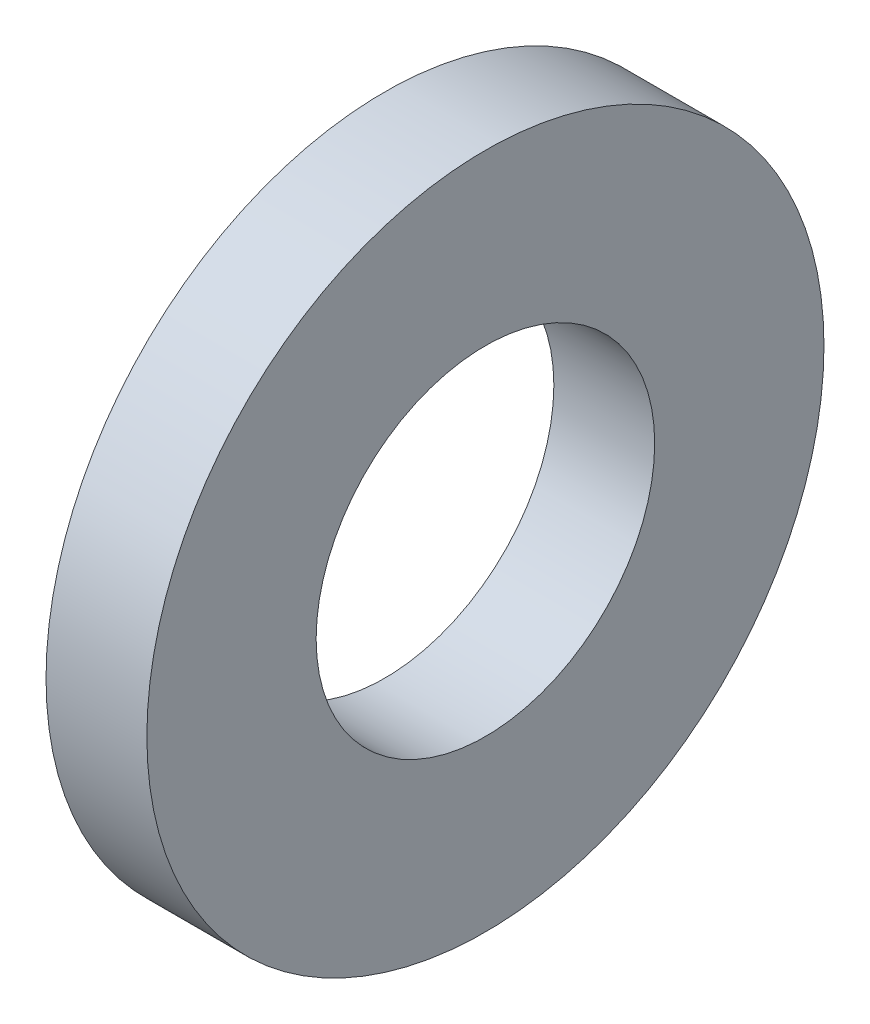
from build123d import *

# Parameters (mm, degrees)
SKETCH1_R           = 2.3876
SKETCH1_R_2         = 1.1938
BOSS_EXTRUDE1_DEPTH = 0.7112


with BuildPart() as part:
    # Sketch1 → Boss-Extrude1 (new body)
    with BuildSketch(Plane(origin=(0, 0, 0), x_dir=(0, 0, -1), z_dir=(1, 0, 0))):
        Circle(SKETCH1_R)
        Circle(SKETCH1_R_2, mode=Mode.SUBTRACT)
    extrude(amount=BOSS_EXTRUDE1_DEPTH)


solid = part.part
